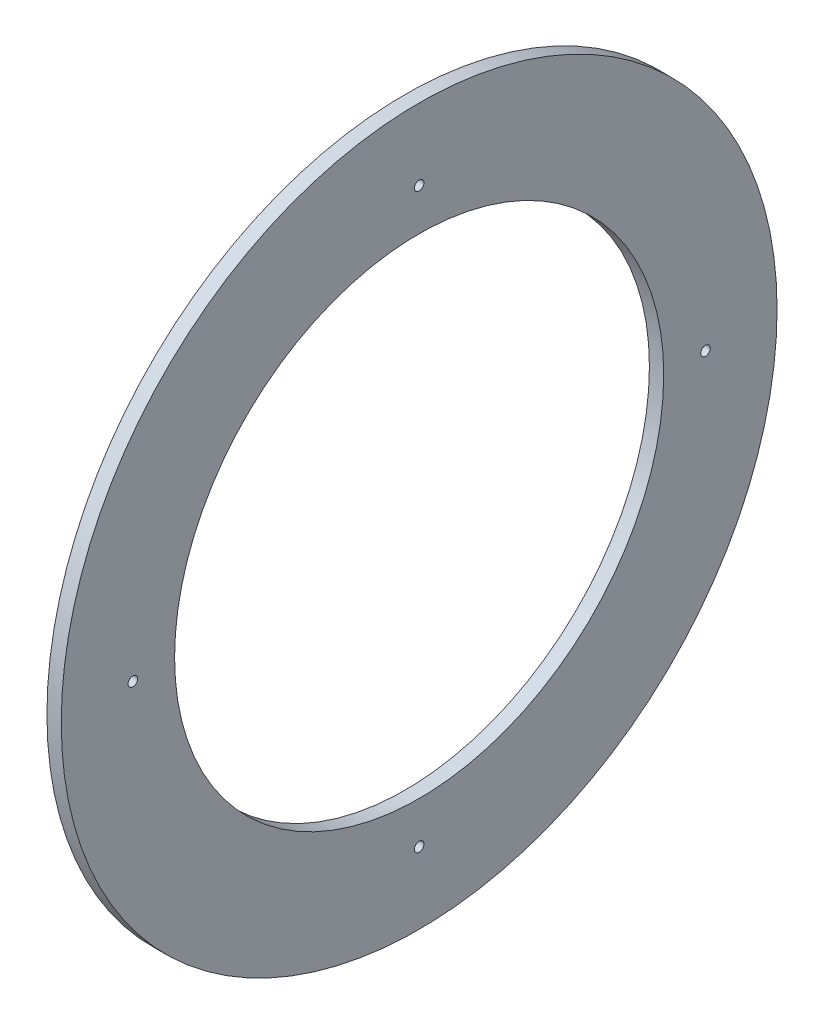
from build123d import *

# Parameters (mm, degrees)
ESQUISSE1_R        = 75
ESQUISSE1_R_2      = 51.25
BOSS_EXTRU_1_DEPTH = 3
SKETCH1_R          = 1
AIR_VENTS_DEPTH    = 107.108435103


with BuildPart() as part:
    # Esquisse1 → Boss.-Extru.1 (new body)
    with BuildSketch(Plane(origin=(0, 0, 0), x_dir=(0, 0, -1), z_dir=(1, 0, 0))):
        Circle(ESQUISSE1_R)
        Circle(ESQUISSE1_R_2, mode=Mode.SUBTRACT)
    extrude(amount=BOSS_EXTRU_1_DEPTH)

    # Sketch1 → air vents (cut, through all)
    with BuildSketch(Plane(origin=(3, 0, 0), x_dir=(0, 0, -1), z_dir=(1, 0, 0))):
        with Locations((0, 60)):
            Circle(SKETCH1_R)
        with Locations((60, 0)):
            Circle(SKETCH1_R)
        with Locations((0, -60)):
            Circle(SKETCH1_R)
        with Locations((-60, 0)):
            Circle(SKETCH1_R)
    extrude(amount=-AIR_VENTS_DEPTH, mode=Mode.SUBTRACT)


solid = part.part
